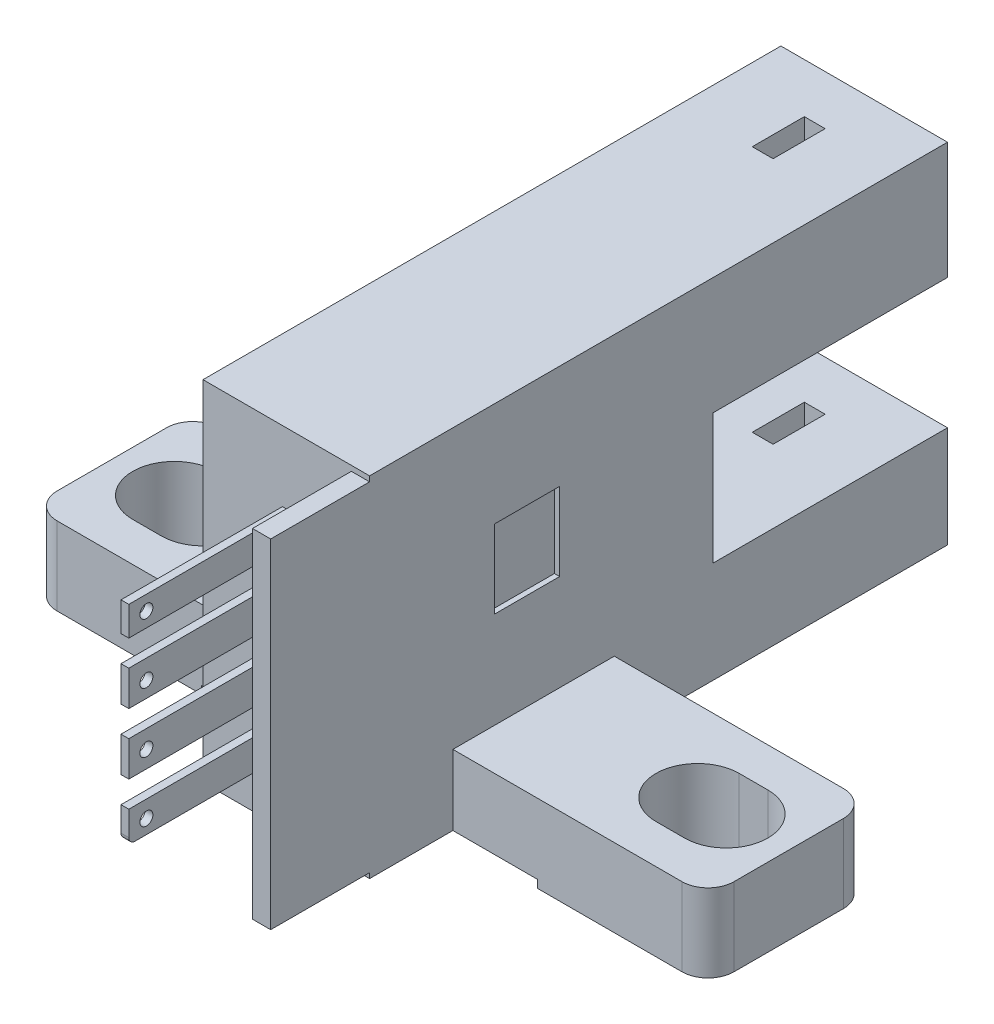
from build123d import *

# Parameters (mm, degrees)
SKETCH1_W                = 6.4
SKETCH1_H                = 22.2
SKETCH1_W_2              = 0.8
SKETCH1_H_2              = 2
BOSS_EXTRUDE1_DEPTH      = 13.7
BOSS_EXTRUDE2_DEPTH      = 3
SKETCH2_W                = 9
SKETCH2_H                = 5
CUT_EXTRUDE1_DEPTH       = 27.513015672
SKETCH2_3_W              = 2.5
SKETCH2_3_H              = 3
CUT_EXTRUDE2_DEPTH       = 0.2
CUT_EXTRUDE3_DEPTH       = 0.3
BOSS_EXTRUDE3_DEPTH      = 6.5
BOSS_EXTRUDE3_DEPTH_BACK = 6.5
SKETCH4_W                = 0.7
SKETCH4_H                = 3.8
BOSS_EXTRUDE4_DEPTH      = 4
BOSS_EXTRUDE4_DEPTH_BACK = 4
SKETCH4_3_W              = 0.3
SKETCH4_3_H              = 6.2
SKETCH7_R                = 0.25
SKETCH7_W                = 6.2
SKETCH7_H                = 1
CUT_EXTRUDE4_DEPTH       = 1


with BuildPart() as part:
    # Sketch1 → Boss-Extrude1 (new body)
    with BuildSketch(Plane(origin=(0, 0, 0), x_dir=(1, 0, 0), z_dir=(0, 1, 0))):
        with Locations((0, 4.8)):
            Rectangle(SKETCH1_W, SKETCH1_H)
        with Locations((0, 13)):
            Rectangle(SKETCH1_W_2, SKETCH1_H_2, mode=Mode.SUBTRACT)
    extrude(amount=BOSS_EXTRUDE1_DEPTH)

    # Sketch1<4> → Boss-Extrude2 (add)
    # profile 1 of 2: a face of its own
    with BuildSketch(Plane(origin=(0, 0, 0), x_dir=(1, 0, 0), z_dir=(0, 1, 0))):
        with BuildLine():
            Line((-3.2, -3.1), (-3.2, 3.1))
            Line((-3.2, 3.1), (-12, 3.1))
            ThreePointArc((-12, 3.1), (-12.707106781, 2.807106781), (-13, 2.1))
            Line((-13, 2.1), (-13, -2.1))
            ThreePointArc((-13, -2.1), (-12.707106781, -2.807106781), (-12, -3.1))
            Line((-12, -3.1), (-3.2, -3.1))
        make_face()
        with BuildLine():
            ThreePointArc((-10.6, -1.6), (-12.2, 0), (-10.6, 1.6))
            Line((-10.6, 1.6), (-9.5, 1.6))
            ThreePointArc((-9.5, 1.6), (-7.9, 0), (-9.5, -1.6))
            Line((-9.5, -1.6), (-10.6, -1.6))
        make_face(mode=Mode.SUBTRACT)
    # profile 2 of 2: a face of its own
    with BuildSketch(Plane(origin=(0, 0, 0), x_dir=(1, 0, 0), z_dir=(0, 1, 0))):
        with BuildLine():
            Line((12, 3.1), (3.2, 3.1))
            Line((3.2, 3.1), (3.2, -3.1))
            Line((3.2, -3.1), (12, -3.1))
            ThreePointArc((12, -3.1), (12.707106781, -2.807106781), (13, -2.1))
            Line((13, -2.1), (13, 2.1))
            ThreePointArc((13, 2.1), (12.707106781, 2.807106781), (12, 3.1))
        make_face()
        with BuildLine():
            Line((9.5, 1.6), (10.6, 1.6))
            ThreePointArc((10.6, 1.6), (12.2, 0), (10.6, -1.6))
            Line((10.6, -1.6), (9.5, -1.6))
            ThreePointArc((9.5, -1.6), (7.9, 0), (9.5, 1.6))
        make_face(mode=Mode.SUBTRACT)
    extrude(amount=BOSS_EXTRUDE2_DEPTH)

    # Sketch2 → Cut-Extrude1 (cut, through all)
    with BuildSketch(Plane(origin=(3.2, 0, 0), x_dir=(0, 0, -1), z_dir=(1, 0, 0))):
        with Locations((11.4, 6.7)):
            Rectangle(SKETCH2_W, SKETCH2_H)
    extrude(amount=-CUT_EXTRUDE1_DEPTH, mode=Mode.SUBTRACT)

    # Sketch2<3> → Cut-Extrude2 (cut)
    with BuildSketch(Plane(origin=(3.2, 0, 0), x_dir=(0, 0, -1), z_dir=(1, 0, 0))):
        with Locations((-0.25, 8.2)):
            Rectangle(SKETCH2_3_W, SKETCH2_3_H)
    extrude(amount=-CUT_EXTRUDE2_DEPTH, mode=Mode.SUBTRACT)

    # Sketch3 → Cut-Extrude3 (cut)
    with BuildSketch(Plane.XZ):
        Polygon((-6.45, 3.1), (-3.2, 3.1), (-3.2, 6.3), (3.2, 6.3), (3.2, 3.1), (6.45, 3.1), (6.45, -3.1), (3.2, -3.1), (3.2, -15.9), (-3.2, -15.9), (-3.2, -3.1), (-6.45, -3.1), align=None)
    extrude(amount=-CUT_EXTRUDE3_DEPTH, mode=Mode.SUBTRACT)

    # Sketch4 → Boss-Extrude3 (add, two sides: drawn at the far end of the back side and taken through both)
    with BuildSketch(Plane(origin=(0, 7, 0), x_dir=(1, 0, 0), z_dir=(0, 1, 0)).offset(-BOSS_EXTRUDE3_DEPTH_BACK)):
        with Locations((2.85, -8.2)):
            Rectangle(SKETCH4_W, SKETCH4_H)
    extrude(amount=BOSS_EXTRUDE3_DEPTH + BOSS_EXTRUDE3_DEPTH_BACK)

    # Sketch4<3> → Boss-Extrude4 (add, two sides: drawn at the far end of the back side and taken through both)
    with BuildSketch(Plane(origin=(0, 7, 0), x_dir=(1, 0, 0), z_dir=(0, 1, 0)).offset(-BOSS_EXTRUDE4_DEPTH_BACK)):
        with Locations((0, -9.4)):
            Rectangle(SKETCH4_3_W, SKETCH4_3_H)
    extrude(amount=BOSS_EXTRUDE4_DEPTH + BOSS_EXTRUDE4_DEPTH_BACK)

    # Sketch7 → Cut-Extrude4 (cut)
    with BuildSketch(Plane.ZY.offset(0.15)):
        with Locations((11.824564477, 3.538657992)):
            Circle(SKETCH7_R)
        with Locations((11.824564477, 5.838657992)):
            Circle(SKETCH7_R)
        with Locations((11.824564477, 8.138657992)):
            Circle(SKETCH7_R)
        with Locations((11.824564477, 10.438657992)):
            Circle(SKETCH7_R)
        with BuildLine():
            Line((12.260846454, 3), (12.5, 3))
            Line((12.5, 3), (12.5, 3.239153546))
            ThreePointArc((12.5, 3.239153546), (12.429953548, 3.070046452), (12.260846454, 3))
        make_face()
        with Locations((9.4, 7.031126654)):
            Rectangle(SKETCH7_W, SKETCH7_H)
        with Locations((9.4, 9.376221563)):
            Rectangle(SKETCH7_W, SKETCH7_H)
        with Locations((9.4, 4.685096472)):
            Rectangle(SKETCH7_W, SKETCH7_H)
    extrude(amount=-CUT_EXTRUDE4_DEPTH, mode=Mode.SUBTRACT)


solid = part.part
